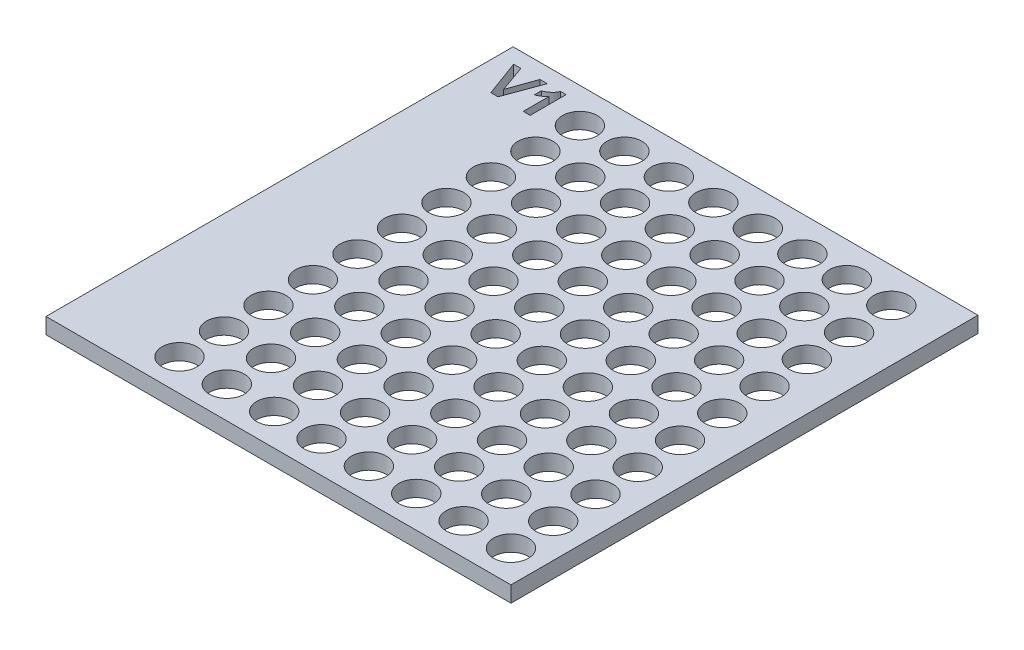
from build123d import *

# Parameters (mm, degrees)
SKETCH1_W           = 92.9005
SKETCH1_H           = 93.323276942
SKETCH1_R           = 3.4925
BOSS_EXTRUDE1_DEPTH = 3.175


with BuildPart() as part:
    # Sketch1 → Boss-Extrude1 (new body)
    with BuildSketch(Plane(origin=(0, 0, 0), x_dir=(1, 0, 0), z_dir=(0, 1, 0))):
        Rectangle(SKETCH1_W, SKETCH1_H)
        with Locations(Location((-26.13025, 39.698361529, 0), (0, 0, 270))):
            Circle(SKETCH1_R, mode=Mode.SUBTRACT)
        with Locations(Location((-26.13025, 30.808361529, 0), (0, 0, 270))):
            Circle(SKETCH1_R, mode=Mode.SUBTRACT)
        with Locations(Location((-26.13025, 21.918361529, 0), (0, 0, 270))):
            Circle(SKETCH1_R, mode=Mode.SUBTRACT)
        with Locations(Location((-26.13025, 13.028361529, 0), (0, 0, 270))):
            Circle(SKETCH1_R, mode=Mode.SUBTRACT)
        with Locations(Location((-26.13025, 4.138361529, 0), (0, 0, 270))):
            Circle(SKETCH1_R, mode=Mode.SUBTRACT)
        with Locations(Location((-26.13025, -4.751638471, 0), (0, 0, 270))):
            Circle(SKETCH1_R, mode=Mode.SUBTRACT)
        with Locations(Location((-26.13025, -13.641638471, 0), (0, 0, 270))):
            Circle(SKETCH1_R, mode=Mode.SUBTRACT)
        with Locations(Location((-26.13025, -22.531638471, 0), (0, 0, 270))):
            Circle(SKETCH1_R, mode=Mode.SUBTRACT)
        with Locations(Location((-26.13025, -31.421638471, 0), (0, 0, 270))):
            Circle(SKETCH1_R, mode=Mode.SUBTRACT)
        with Locations(Location((-26.13025, -40.311638471, 0), (0, 0, 270))):
            Circle(SKETCH1_R, mode=Mode.SUBTRACT)
        with Locations(Location((-16.98625, 4.138361529, 0), (0, 0, 270))):
            Circle(SKETCH1_R, mode=Mode.SUBTRACT)
        with Locations(Location((-7.84225, 4.138361529, 0), (0, 0, 270))):
            Circle(SKETCH1_R, mode=Mode.SUBTRACT)
        with Locations(Location((1.30175, 4.138361529, 0), (0, 0, 270))):
            Circle(SKETCH1_R, mode=Mode.SUBTRACT)
        with Locations(Location((10.44575, 4.138361529, 0), (0, 0, 270))):
            Circle(SKETCH1_R, mode=Mode.SUBTRACT)
        with Locations(Location((19.58975, 4.138361529, 0), (0, 0, 270))):
            Circle(SKETCH1_R, mode=Mode.SUBTRACT)
        with Locations(Location((28.73375, 4.138361529, 0), (0, 0, 270))):
            Circle(SKETCH1_R, mode=Mode.SUBTRACT)
        with Locations(Location((37.87775, 4.138361529, 0), (0, 0, 270))):
            Circle(SKETCH1_R, mode=Mode.SUBTRACT)
        with Locations(Location((-17.04975, 13.028361529, 0), (0, 0, 270))):
            Circle(SKETCH1_R, mode=Mode.SUBTRACT)
        with Locations(Location((-7.96925, 13.028361529, 0), (0, 0, 270))):
            Circle(SKETCH1_R, mode=Mode.SUBTRACT)
        with Locations(Location((1.11125, 13.028361529, 0), (0, 0, 270))):
            Circle(SKETCH1_R, mode=Mode.SUBTRACT)
        with Locations(Location((10.19175, 13.028361529, 0), (0, 0, 270))):
            Circle(SKETCH1_R, mode=Mode.SUBTRACT)
        with Locations(Location((19.27225, 13.028361529, 0), (0, 0, 270))):
            Circle(SKETCH1_R, mode=Mode.SUBTRACT)
        with Locations(Location((28.35275, 13.028361529, 0), (0, 0, 270))):
            Circle(SKETCH1_R, mode=Mode.SUBTRACT)
        with Locations(Location((37.43325, 13.028361529, 0), (0, 0, 270))):
            Circle(SKETCH1_R, mode=Mode.SUBTRACT)
        with Locations(Location((-17.11325, 21.918361529, 0), (0, 0, 270))):
            Circle(SKETCH1_R, mode=Mode.SUBTRACT)
        with Locations(Location((-8.09625, 21.918361529, 0), (0, 0, 270))):
            Circle(SKETCH1_R, mode=Mode.SUBTRACT)
        with Locations(Location((0.92075, 21.918361529, 0), (0, 0, 270))):
            Circle(SKETCH1_R, mode=Mode.SUBTRACT)
        with Locations(Location((9.93775, 21.918361529, 0), (0, 0, 270))):
            Circle(SKETCH1_R, mode=Mode.SUBTRACT)
        with Locations(Location((18.95475, 21.918361529, 0), (0, 0, 270))):
            Circle(SKETCH1_R, mode=Mode.SUBTRACT)
        with Locations(Location((27.97175, 21.918361529, 0), (0, 0, 270))):
            Circle(SKETCH1_R, mode=Mode.SUBTRACT)
        with Locations(Location((36.98875, 21.918361529, 0), (0, 0, 270))):
            Circle(SKETCH1_R, mode=Mode.SUBTRACT)
        with Locations(Location((-17.17675, 30.808361529, 0), (0, 0, 270))):
            Circle(SKETCH1_R, mode=Mode.SUBTRACT)
        with Locations(Location((-8.22325, 30.808361529, 0), (0, 0, 270))):
            Circle(SKETCH1_R, mode=Mode.SUBTRACT)
        with Locations(Location((0.73025, 30.808361529, 0), (0, 0, 270))):
            Circle(SKETCH1_R, mode=Mode.SUBTRACT)
        with Locations(Location((9.68375, 30.808361529, 0), (0, 0, 270))):
            Circle(SKETCH1_R, mode=Mode.SUBTRACT)
        with Locations(Location((18.63725, 30.808361529, 0), (0, 0, 270))):
            Circle(SKETCH1_R, mode=Mode.SUBTRACT)
        with Locations(Location((27.59075, 30.808361529, 0), (0, 0, 270))):
            Circle(SKETCH1_R, mode=Mode.SUBTRACT)
        with Locations(Location((36.54425, 30.808361529, 0), (0, 0, 270))):
            Circle(SKETCH1_R, mode=Mode.SUBTRACT)
        with Locations(Location((-17.24025, 39.698361529, 0), (0, 0, 270))):
            Circle(SKETCH1_R, mode=Mode.SUBTRACT)
        with Locations(Location((-8.35025, 39.698361529, 0), (0, 0, 270))):
            Circle(SKETCH1_R, mode=Mode.SUBTRACT)
        with Locations(Location((0.53975, 39.698361529, 0), (0, 0, 270))):
            Circle(SKETCH1_R, mode=Mode.SUBTRACT)
        with Locations(Location((9.42975, 39.698361529, 0), (0, 0, 270))):
            Circle(SKETCH1_R, mode=Mode.SUBTRACT)
        with Locations(Location((18.31975, 39.698361529, 0), (0, 0, 270))):
            Circle(SKETCH1_R, mode=Mode.SUBTRACT)
        with Locations(Location((27.20975, 39.698361529, 0), (0, 0, 270))):
            Circle(SKETCH1_R, mode=Mode.SUBTRACT)
        with Locations(Location((36.09975, 39.698361529, 0), (0, 0, 270))):
            Circle(SKETCH1_R, mode=Mode.SUBTRACT)
        with Locations(Location((-16.92275, -4.751638471, 0), (0, 0, 270))):
            Circle(SKETCH1_R, mode=Mode.SUBTRACT)
        with Locations(Location((-7.71525, -4.751638471, 0), (0, 0, 270))):
            Circle(SKETCH1_R, mode=Mode.SUBTRACT)
        with Locations(Location((1.49225, -4.751638471, 0), (0, 0, 270))):
            Circle(SKETCH1_R, mode=Mode.SUBTRACT)
        with Locations(Location((10.69975, -4.751638471, 0), (0, 0, 270))):
            Circle(SKETCH1_R, mode=Mode.SUBTRACT)
        with Locations(Location((19.90725, -4.751638471, 0), (0, 0, 270))):
            Circle(SKETCH1_R, mode=Mode.SUBTRACT)
        with Locations(Location((29.11475, -4.751638471, 0), (0, 0, 270))):
            Circle(SKETCH1_R, mode=Mode.SUBTRACT)
        with Locations(Location((38.32225, -4.751638471, 0), (0, 0, 270))):
            Circle(SKETCH1_R, mode=Mode.SUBTRACT)
        with Locations(Location((-16.85925, -13.641638471, 0), (0, 0, 270))):
            Circle(SKETCH1_R, mode=Mode.SUBTRACT)
        with Locations(Location((-7.58825, -13.641638471, 0), (0, 0, 270))):
            Circle(SKETCH1_R, mode=Mode.SUBTRACT)
        with Locations(Location((1.68275, -13.641638471, 0), (0, 0, 270))):
            Circle(SKETCH1_R, mode=Mode.SUBTRACT)
        with Locations(Location((10.95375, -13.641638471, 0), (0, 0, 270))):
            Circle(SKETCH1_R, mode=Mode.SUBTRACT)
        with Locations(Location((20.22475, -13.641638471, 0), (0, 0, 270))):
            Circle(SKETCH1_R, mode=Mode.SUBTRACT)
        with Locations(Location((29.49575, -13.641638471, 0), (0, 0, 270))):
            Circle(SKETCH1_R, mode=Mode.SUBTRACT)
        with Locations(Location((38.76675, -13.641638471, 0), (0, 0, 270))):
            Circle(SKETCH1_R, mode=Mode.SUBTRACT)
        with Locations(Location((-16.79575, -22.531638471, 0), (0, 0, 270))):
            Circle(SKETCH1_R, mode=Mode.SUBTRACT)
        with Locations(Location((-7.46125, -22.531638471, 0), (0, 0, 270))):
            Circle(SKETCH1_R, mode=Mode.SUBTRACT)
        with Locations(Location((1.87325, -22.531638471, 0), (0, 0, 270))):
            Circle(SKETCH1_R, mode=Mode.SUBTRACT)
        with Locations(Location((11.20775, -22.531638471, 0), (0, 0, 270))):
            Circle(SKETCH1_R, mode=Mode.SUBTRACT)
        with Locations(Location((20.54225, -22.531638471, 0), (0, 0, 270))):
            Circle(SKETCH1_R, mode=Mode.SUBTRACT)
        with Locations(Location((29.87675, -22.531638471, 0), (0, 0, 270))):
            Circle(SKETCH1_R, mode=Mode.SUBTRACT)
        with Locations(Location((39.21125, -22.531638471, 0), (0, 0, 270))):
            Circle(SKETCH1_R, mode=Mode.SUBTRACT)
        with Locations(Location((-16.73225, -31.421638471, 0), (0, 0, 270))):
            Circle(SKETCH1_R, mode=Mode.SUBTRACT)
        with Locations(Location((-7.33425, -31.421638471, 0), (0, 0, 270))):
            Circle(SKETCH1_R, mode=Mode.SUBTRACT)
        with Locations(Location((2.06375, -31.421638471, 0), (0, 0, 270))):
            Circle(SKETCH1_R, mode=Mode.SUBTRACT)
        with Locations(Location((11.46175, -31.421638471, 0), (0, 0, 270))):
            Circle(SKETCH1_R, mode=Mode.SUBTRACT)
        with Locations(Location((20.85975, -31.421638471, 0), (0, 0, 270))):
            Circle(SKETCH1_R, mode=Mode.SUBTRACT)
        with Locations(Location((30.25775, -31.421638471, 0), (0, 0, 270))):
            Circle(SKETCH1_R, mode=Mode.SUBTRACT)
        with Locations(Location((39.65575, -31.421638471, 0), (0, 0, 270))):
            Circle(SKETCH1_R, mode=Mode.SUBTRACT)
        with Locations(Location((-16.66875, -40.311638471, 0), (0, 0, 270))):
            Circle(SKETCH1_R, mode=Mode.SUBTRACT)
        with Locations(Location((-7.20725, -40.311638471, 0), (0, 0, 270))):
            Circle(SKETCH1_R, mode=Mode.SUBTRACT)
        with Locations(Location((2.25425, -40.311638471, 0), (0, 0, 270))):
            Circle(SKETCH1_R, mode=Mode.SUBTRACT)
        with Locations(Location((11.71575, -40.311638471, 0), (0, 0, 270))):
            Circle(SKETCH1_R, mode=Mode.SUBTRACT)
        with Locations(Location((21.17725, -40.311638471, 0), (0, 0, 270))):
            Circle(SKETCH1_R, mode=Mode.SUBTRACT)
        with Locations(Location((30.63875, -40.311638471, 0), (0, 0, 270))):
            Circle(SKETCH1_R, mode=Mode.SUBTRACT)
        with Locations(Location((40.10025, -40.311638471, 0), (0, 0, 270))):
            Circle(SKETCH1_R, mode=Mode.SUBTRACT)
        with BuildLine():
            Line((-32.869778996, 36.501638471), (-34.252719827, 36.501638471))
            Line((-34.252719827, 36.501638471), (-34.252719827, 41.62140067))
            add(Edge.make_bspline(
                [(-34.252719827, 41.62140067), (-34.315402134, 41.557766435), (-34.439916397, 41.43136123), (-34.638785289, 41.255042826), (-34.845241518, 41.091020222), (-35.061328159, 40.940851333), (-35.284220406, 40.802396517), (-35.516196093, 40.676748237), (-35.755573779, 40.562167971), (-35.921401067, 40.4981354), (-36.004444878, 40.466068851)],
                knots=[0, 0, 0, 0, 1.012567276, 2.011397996, 3.011400399, 4.000747768, 4.993445519, 5.985067596, 6.990952157, 8, 8, 8, 8], degree=3))
            Line((-36.004444878, 40.466068851), (-36.004444878, 41.849009681))
            add(Edge.make_bspline(
                [(-36.004444878, 41.849009681), (-35.912345111, 41.883543142), (-35.719587462, 41.955818989), (-35.435141994, 42.109553378), (-35.138245168, 42.299892063), (-34.888834885, 42.486570234), (-34.690813374, 42.652542046), (-34.552411392, 42.785957341), (-34.424173998, 42.922581523), (-34.310921381, 43.066824321), (-34.209680605, 43.215769462), (-34.119976864, 43.36917362), (-34.041016951, 43.527521389), (-33.999681989, 43.637791263), (-33.979012787, 43.692930789)],
                knots=[0, 0, 0, 0, 1.253673617, 2.623841347, 4.114270668, 5.751233548, 6.594491912, 7.409089316, 8.202422231, 8.983165545, 9.746111525, 10.498431446, 11.249153235, 12, 12, 12, 12], degree=3))
            Line((-33.979012787, 43.692930789), (-32.869778996, 43.692930789))
            Line((-32.869778996, 43.692930789), (-32.869778996, 36.501638471))
        make_face(mode=Mode.SUBTRACT)
        Polygon((-40.720849335, 36.501638471), (-43.380129307, 43.692930789), (-41.919398055, 43.692930789), (-40.014973286, 38.345559578), (-38.117751335, 43.692930789), (-36.649817266, 43.692930789), (-39.299013294, 36.501638471), align=None, mode=Mode.SUBTRACT)
    extrude(amount=BOSS_EXTRUDE1_DEPTH)


solid = part.part
